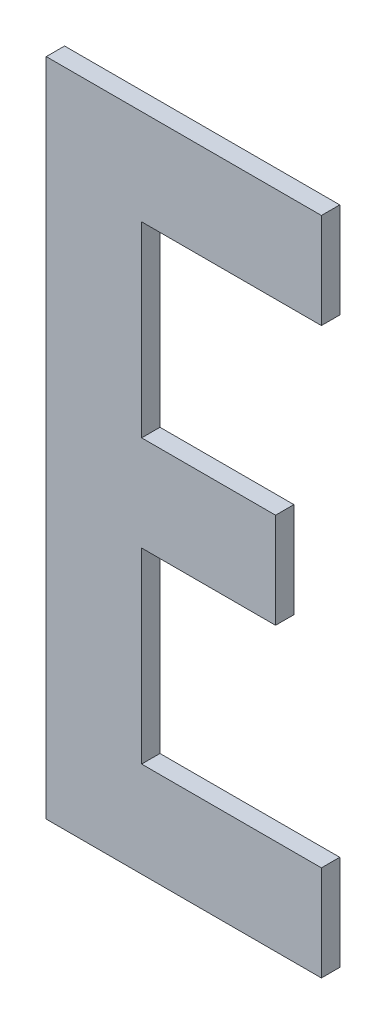
from build123d import *

# Parameters (mm, degrees)
BOSS_EXTRUDE1_DEPTH = 25.4


with BuildPart() as part:
    # Sketch1 → Boss-Extrude1 (new body)
    with BuildSketch(Plane.XY):
        Polygon((0, 374.566226913), (0, -539.833773087), (381, -539.833773087), (381, -407.753773087), (132.08, -407.753773087), (132.08, -148.673773087), (317.5, -148.673773087), (317.5, -16.593773087), (132.08, -16.593773087), (132.08, 242.486226913), (381, 242.486226913), (381, 374.566226913), align=None)
    extrude(amount=BOSS_EXTRUDE1_DEPTH)


solid = part.part
